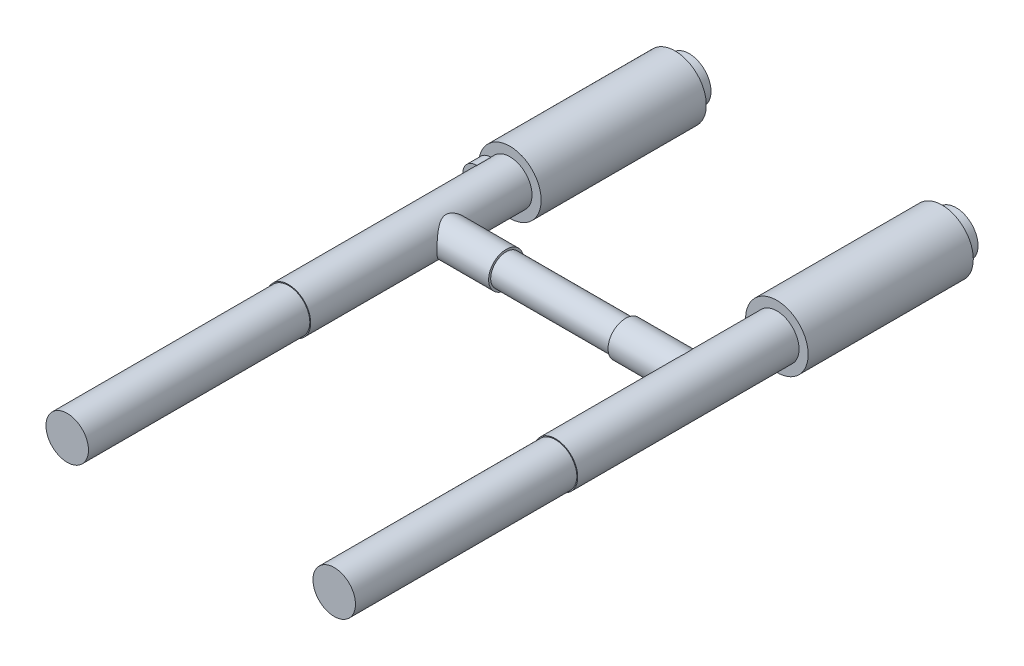
from build123d import *

# Parameters (mm, degrees)
SKETCH1_R           = 7.9375
BOSS_EXTRUDE1_DEPTH = 5.08
SKETCH2_R           = 11.303
BOSS_EXTRUDE2_DEPTH = 59.69
SKETCH3_R           = 8.001
BOSS_EXTRUDE3_DEPTH = 80.01
SKETCH4_R           = 7.6835
BOSS_EXTRUDE4_DEPTH = 80.01
SKETCH6_W           = 5.08
SKETCH6_H           = 12.7
BOSS_EXTRUDE5_DEPTH = 10.01
FILLET1_R           = 5
SKETCH7_R           = 6.35
BOSS_EXTRUDE6_DEPTH = 26.67
SKETCH8_R           = 5.588
BOSS_EXTRUDE7_DEPTH = 21.59


with BuildPart() as part:
    # Sketch1 → Boss-Extrude1 (new body)
    with BuildSketch(Plane.XY):
        Circle(SKETCH1_R)
    boss_extrude1 = extrude(amount=BOSS_EXTRUDE1_DEPTH)

    # Sketch2 → Boss-Extrude2 (add)
    with BuildSketch(Plane.XY.offset(5.08)):
        with Locations(Location((0, 0, 0), (0, 0, 180))):
            Circle(SKETCH2_R)
    boss_extrude2 = extrude(amount=BOSS_EXTRUDE2_DEPTH)

    # Sketch3 → Boss-Extrude3 (add)
    with BuildSketch(Plane.XY.offset(64.77)):
        Circle(SKETCH3_R)
    boss_extrude3 = extrude(amount=BOSS_EXTRUDE3_DEPTH)

    # Sketch4 → Boss-Extrude4 (add)
    with BuildSketch(Plane.XY.offset(144.78)):
        Circle(SKETCH4_R)
    boss_extrude4 = extrude(amount=BOSS_EXTRUDE4_DEPTH)

    # Sketch6 → Boss-Extrude5 (add)
    with BuildSketch(Plane(origin=(0, 0, 0), x_dir=(0, 0, -1), z_dir=(1, 0, 0))):
        with Locations((-69.261191794, 0)):
            Rectangle(SKETCH6_W, SKETCH6_H)
    extrude(amount=-BOSS_EXTRUDE5_DEPTH)

    # Fillet1
    fillet1_edges = [part.edges().sort_by_distance(p)[0] for p in [
        (-10.01, -6.35, 69.261191794),
        (-10.01, 6.35, 69.261191794),
    ]]
    fillet(fillet1_edges, radius=FILLET1_R)

    # Sketch7 → Boss-Extrude6 (add)
    with BuildSketch(Plane(origin=(0, 0, 0), x_dir=(0, 0, -1), z_dir=(1, 0, 0))):
        with Locations((-92.78865741, 0)):
            Circle(SKETCH7_R)
    boss_extrude6 = extrude(amount=BOSS_EXTRUDE6_DEPTH)

    # Sketch8 → Boss-Extrude7 (add)
    with BuildSketch(Plane(origin=(26.67, 0, 0), x_dir=(0, 0, -1), z_dir=(1, 0, 0))):
        with Locations((-92.78865741, 0)):
            Circle(SKETCH8_R)
    boss_extrude7 = extrude(amount=BOSS_EXTRUDE7_DEPTH)

    # Mirror2: Boss-Extrude1, Boss-Extrude2, Boss-Extrude3, Boss-Extrude4, Boss-Extrude6, Boss-Extrude7 across plane
    add(boss_extrude1.mirror(Plane(origin=(48.26, 0, 92.78865741), x_dir=(0, 0, 1), z_dir=(1, 0, 0))))
    add(boss_extrude2.mirror(Plane(origin=(48.26, 0, 92.78865741), x_dir=(0, 0, 1), z_dir=(1, 0, 0))))
    add(boss_extrude3.mirror(Plane(origin=(48.26, 0, 92.78865741), x_dir=(0, 0, 1), z_dir=(1, 0, 0))))
    add(boss_extrude4.mirror(Plane(origin=(48.26, 0, 92.78865741), x_dir=(0, 0, 1), z_dir=(1, 0, 0))))
    add(boss_extrude6.mirror(Plane(origin=(48.26, 0, 92.78865741), x_dir=(0, 0, 1), z_dir=(1, 0, 0))))
    add(boss_extrude7.mirror(Plane(origin=(48.26, 0, 92.78865741), x_dir=(0, 0, 1), z_dir=(1, 0, 0))))


solid = part.part
